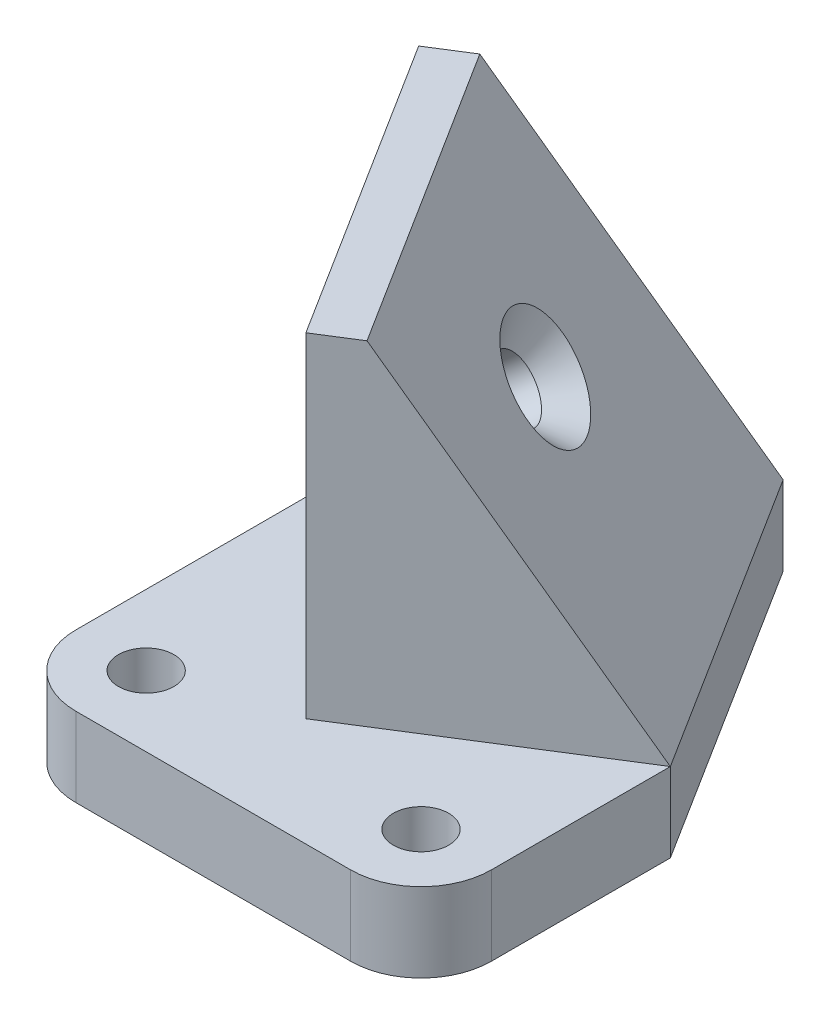
from build123d import *

# Parameters (mm, degrees)
BASE_EXTRUDE_DEPTH                               = 14.2875
BOSS_EXTRUDE1_DEPTH                              = 60.325
CUT_EXTRUDE1_DEPTH                               = 115.691718555
CSK_FOR_M10_FLAT_HEAD_MACHINE_SCREW1_D           = 11
CSK_FOR_M10_FLAT_HEAD_MACHINE_SCREW1_DEPTH       = 25.4
CSK_FOR_M10_FLAT_HEAD_MACHINE_SCREW1_CSINK_D     = 20
CSK_FOR_M10_FLAT_HEAD_MACHINE_SCREW1_CSINK_ANGLE = 90
CSK_FOR_M10_FLAT_HEAD_MACHINE_SCREW1_TIP         = 3.304733405
FILLET1_R                                        = 12.7
F_10_0_10_DIAMETER_HOLE1_D                       = 10


with BuildPart() as part:
    # Sketch1 → Base-Extrude (new body)
    with BuildSketch(Plane(origin=(0, 0, 0), x_dir=(1, 0, 0), z_dir=(0, 1, 0))):
        Polygon((0, 0), (0, 45), (-34.641016151, 100), (-75, 74.580432521), (-75, 0), align=None)
    extrude(amount=BASE_EXTRUDE_DEPTH)

    # Sketch2 → Boss-Extrude1 (add)
    with BuildSketch(Plane(origin=(0, 14.2875, 0), x_dir=(-1, 0, 0), z_dir=(0, 1, 0))):
        Polygon((34.641016151, -100), (75, -74.580432521), (40.358983849, -19.580432521), (0, -45), align=None)
    extrude(amount=BOSS_EXTRUDE1_DEPTH)

    # Sketch3 → Cut-Extrude1 (cut, through all)
    with BuildSketch(Plane(origin=(-20.292666266, 0, -32.218934911), x_dir=(0.846153846153846, 0, -0.5329387100211933), z_dir=(0.5329387100211932, 0, 0.8461538461538459))):
        Polygon((-138.006469686, 260.451535778), (-15.714738961, 74.6125), (23.982241951, 14.2875), (146.273972676, -171.551535778), (517.952044233, 73.031925672), (233.67160187, 505.034997229), align=None)
    extrude(amount=-CUT_EXTRUDE1_DEPTH, mode=Mode.SUBTRACT)

    # CSK for M10 Flat Head Machine Screw1
    with Locations(Plane(origin=(19.712140487, 15.330086336, -12.415428673), x_dir=(-0.36778462315379085, -0.25201220679427455, -0.8951113442462362), z_dir=(0.7068403651551289, 0.549708126864638, -0.4451939728324442))):
        with Locations((53.6091088, 60.43353944)):
            CounterSinkHole(CSK_FOR_M10_FLAT_HEAD_MACHINE_SCREW1_D / 2, CSK_FOR_M10_FLAT_HEAD_MACHINE_SCREW1_CSINK_D / 2, depth=CSK_FOR_M10_FLAT_HEAD_MACHINE_SCREW1_DEPTH, counter_sink_angle=CSK_FOR_M10_FLAT_HEAD_MACHINE_SCREW1_CSINK_ANGLE)
            with Locations((0, 0, -(CSK_FOR_M10_FLAT_HEAD_MACHINE_SCREW1_DEPTH + CSK_FOR_M10_FLAT_HEAD_MACHINE_SCREW1_TIP / 2))):  # 118° drill point
                Cone(0, CSK_FOR_M10_FLAT_HEAD_MACHINE_SCREW1_D / 2, CSK_FOR_M10_FLAT_HEAD_MACHINE_SCREW1_TIP, mode=Mode.SUBTRACT)

    # Fillet1
    fillet1_edges = [part.edges().sort_by_distance(p)[0] for p in [
        (0, 7.14375, 0),
        (-75, 7.14375, 0),
    ]]
    fillet(fillet1_edges, radius=FILLET1_R)

    # Ø10.0 (10) Diameter Hole1 (through all)
    with Locations(Plane(origin=(0, 14.2875, 0), x_dir=(-1, 0, 0), z_dir=(0, 1, 0))):
        with Locations((12.7, -12.7), (62.3, -12.7)):
            Hole(F_10_0_10_DIAMETER_HOLE1_D / 2)


solid = part.part
